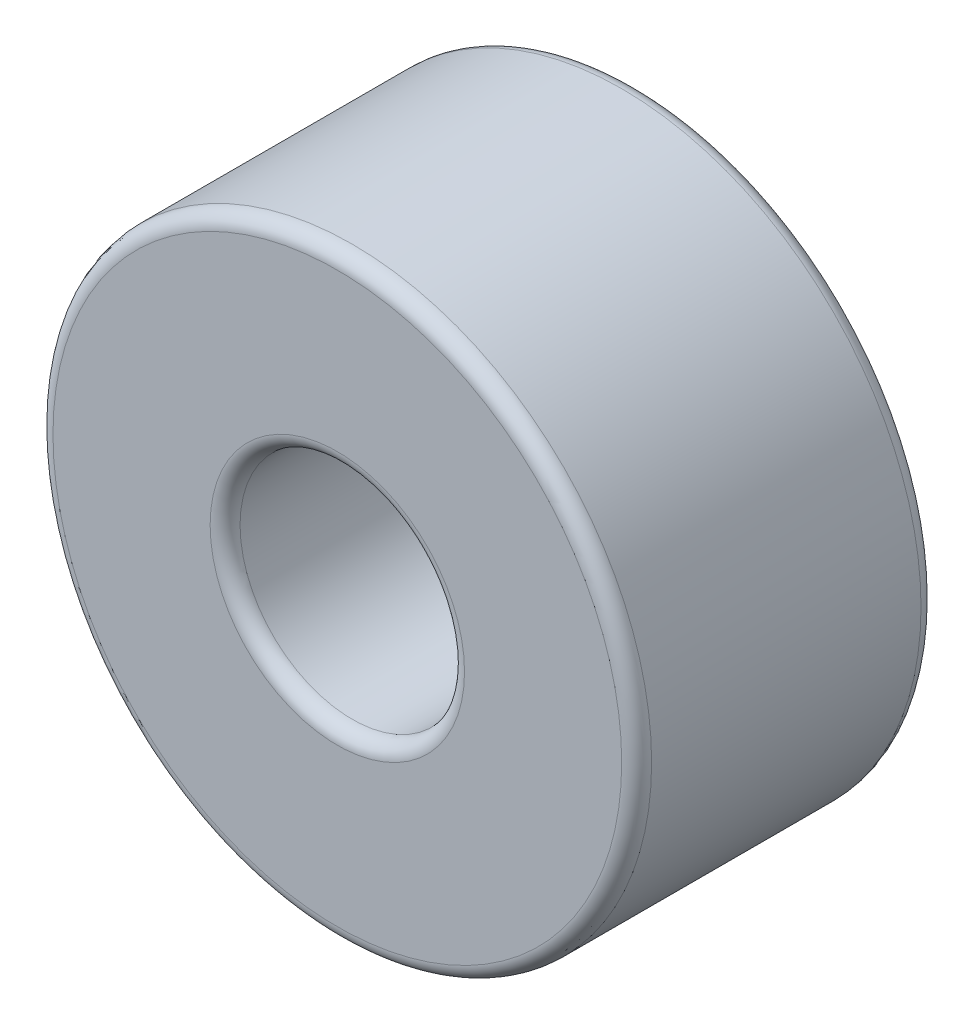
from build123d import *

# Parameters (mm, degrees)
SKETCH_1_R      = 4
SKETCH_1_R_2    = 1.5
EXTRUDE_1_DEPTH = 4
FILLET_1_R      = 0.2


with BuildPart() as part:
    # Эскиз1 → Бобышка-Вытянуть1 (new body)
    with BuildSketch(Plane.XY):
        Circle(SKETCH_1_R)
        Circle(SKETCH_1_R_2, mode=Mode.SUBTRACT)
    extrude(amount=EXTRUDE_1_DEPTH)

    # Скругление1
    fillet_1_edges = [part.edges().sort_by_distance(p)[0] for p in [
        (-4, 0, 0),
        (-4, 0, 4),
        (-1.5, 0, 0),
        (-1.5, 0, 4),
    ]]
    fillet(fillet_1_edges, radius=FILLET_1_R)


solid = part.part
